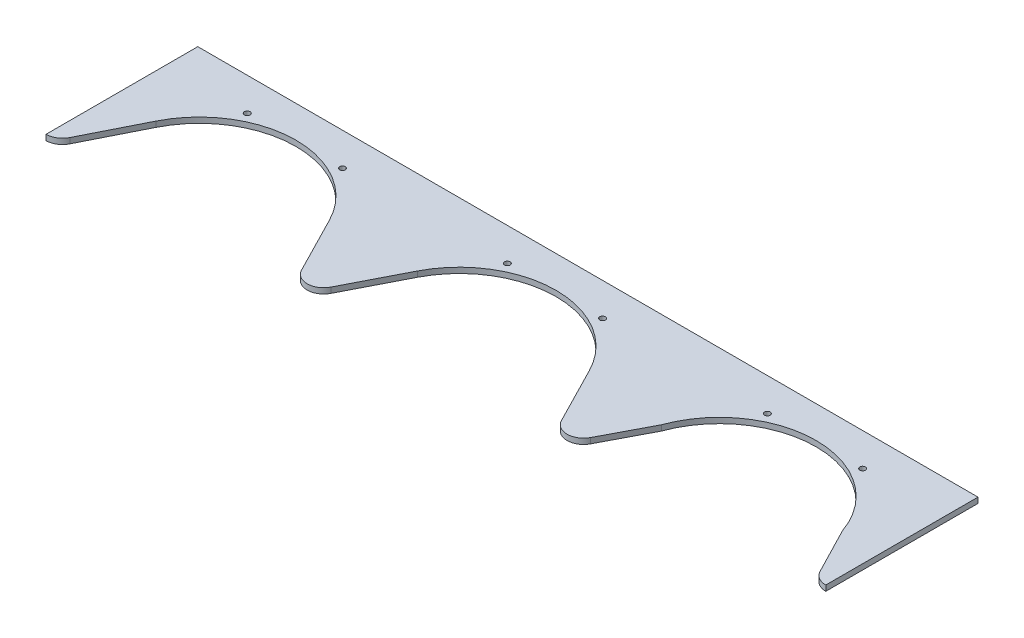
from build123d import *

# Parameters (mm, degrees)
SKETCH1_R           = 1.6383
BOSS_EXTRUDE1_DEPTH = 3.175
FILLET3_R           = 9.525


with BuildPart() as part:
    # Sketch1 → Boss-Extrude1 (new body)
    with BuildSketch(Plane(origin=(0, 0, 0), x_dir=(1, 0, 0), z_dir=(0, 1, 0))):
        with BuildLine():
            Line((-155.195517325, 13.78007871), (-129.789904869, -35.823423436))
            Line((-129.789904869, -35.823423436), (-104.384292413, 13.78007871))
            ThreePointArc((-104.384292413, 13.78007871), (-54.648238202, 44.186576564), (-4.912183992, 13.78007871))
            Line((-4.912183992, 13.78007871), (20.493428464, -35.823423436))
            Line((20.493428464, -35.823423436), (43.089138197, 7.319646013))
            ThreePointArc((43.089138197, 7.319646013), (95.947099994, 44.185705521), (148.390090675, 6.731691085))
            Line((148.390090675, 6.731691085), (162.314428993, -20.219790589))
            ThreePointArc((162.314428993, -20.219790589), (165.822867077, -23.983160647), (170.776761798, -25.372771775))
            Line((170.776761798, -25.372771775), (170.776761798, 62.601576564))
            Line((170.776761798, 62.601576564), (-280.073238202, 62.601576564))
            Line((-280.073238202, 62.601576564), (-280.073238202, -25.107798436))
            ThreePointArc((-280.073238202, -25.107798436), (-275.072672567, -23.689583762), (-271.561214661, -19.857266851))
            Line((-271.561214661, -19.857266851), (-254.868776311, 13.383457934))
            ThreePointArc((-254.868776311, 13.383457934), (-205.153928001, 44.186134164), (-155.195517325, 13.78007871))
        make_face()
        with Locations(Location((-232.439771536, 43.551576564, 0), (0, 0, 270))):
            Circle(SKETCH1_R, mode=Mode.SUBTRACT)
        with Locations(Location((-177.423371536, 43.551576564, 0), (0, 0, 270))):
            Circle(SKETCH1_R, mode=Mode.SUBTRACT)
        with Locations(Location((-27.140038202, 43.551576564, 0), (0, 0, 270))):
            Circle(SKETCH1_R, mode=Mode.SUBTRACT)
        with Locations(Location((-82.156438202, 43.551576564, 0), (0, 0, 270))):
            Circle(SKETCH1_R, mode=Mode.SUBTRACT)
        with Locations(Location((123.143295131, 43.551576564, 0), (0, 0, 270))):
            Circle(SKETCH1_R, mode=Mode.SUBTRACT)
        with Locations(Location((68.126895131, 43.551576564, 0), (0, 0, 270))):
            Circle(SKETCH1_R, mode=Mode.SUBTRACT)
    extrude(amount=-BOSS_EXTRUDE1_DEPTH)

    # Fillet3
    fillet3_edges = [part.edges().sort_by_distance(p)[0] for p in [
        (20.493428464, -1.5875, 35.823423436),
        (-129.789904869, -1.5875, 35.823423436),
    ]]
    fillet(fillet3_edges, radius=FILLET3_R)


solid = part.part
